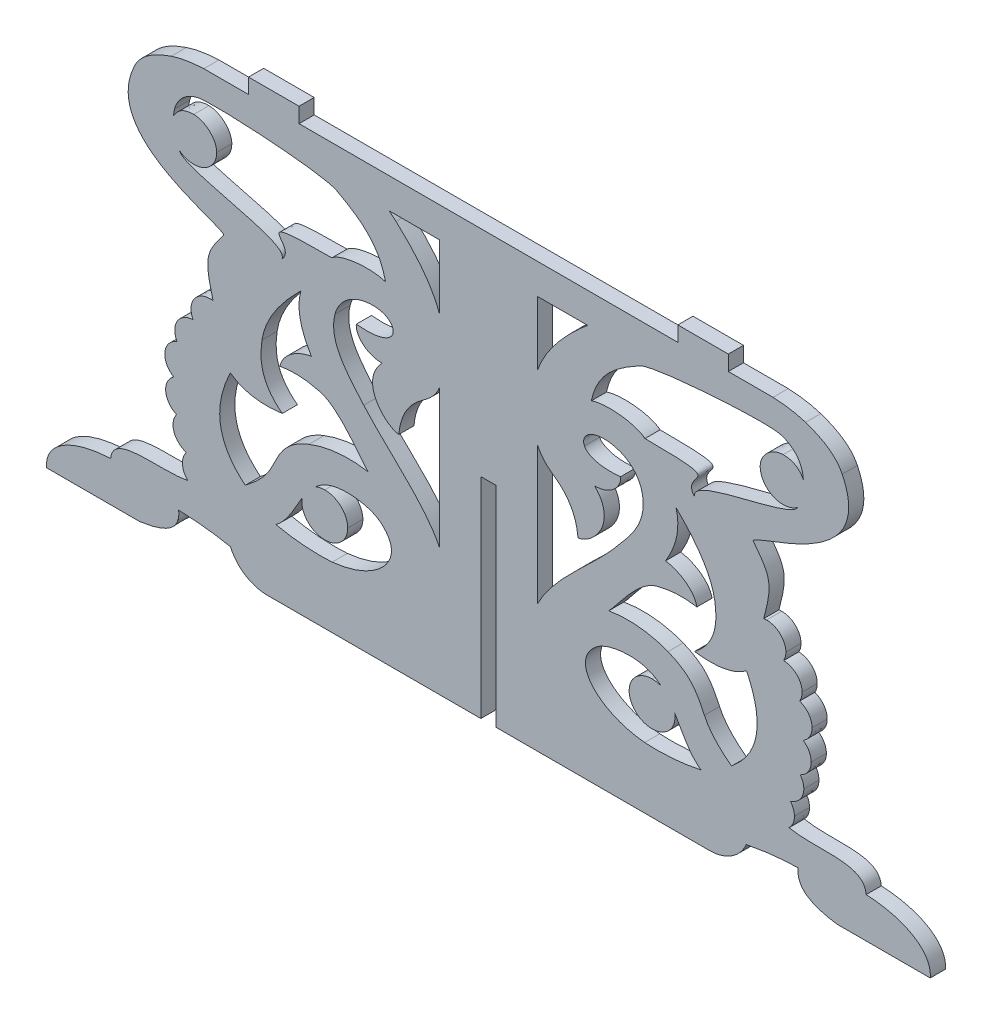
from build123d import *

# Parameters (mm, degrees)
RESSALTO_EXTRUS_O1_DEPTH = 2


with BuildPart() as part:
    # Model → Ressalto-extrusão1 (new body)
    with BuildSketch(Plane.XY):
        with BuildLine():
            Line((-58.0295, -132.7237), (-45.7155, -132.7237))
            add(Edge.make_bspline(
                [(-45.7155, -132.7237), (-42.3585, -132.2526), (-40.3248, -131.1466), (-40.6026, -128.8422)],
                knots=[0.327868852, 0.327868852, 0.327868852, 0.327868852, 0.344262295, 0.344262295, 0.344262295, 0.344262295], degree=3))
            add(Edge.make_bspline(
                [(-40.6026, -128.8422), (-37.8869, -128.9335), (-35.6926, -129.2179), (-33.7519, -129.6077)],
                knots=[0.344262295, 0.344262295, 0.344262295, 0.344262295, 0.360655738, 0.360655738, 0.360655738, 0.360655738], degree=3))
            add(Edge.make_bspline(
                [(-33.7519, -129.6077), (-32.9718, -131.4296), (-31.0759, -132.7237), (-28.8751, -132.7237)],
                knots=[0.360655738, 0.360655738, 0.360655738, 0.360655738, 0.37704918, 0.37704918, 0.37704918, 0.37704918], degree=3))
            Line((-28.8751, -132.7237), (-0.7099, -132.7237))
            Line((-0.7099, -132.7237), (-0.7099, -105.0626))
            Line((-0.7099, -105.0626), (1.2901, -105.0626))
            Line((1.2901, -105.0626), (1.2901, -132.7237))
            Line((1.2901, -132.7237), (29.4553, -132.7237))
            add(Edge.make_bspline(
                [(29.4553, -132.7237), (31.6561, -132.7237), (33.552, -131.4296), (34.3321, -129.6077)],
                knots=[0.459016393, 0.459016393, 0.459016393, 0.459016393, 0.475409836, 0.475409836, 0.475409836, 0.475409836], degree=3))
            add(Edge.make_bspline(
                [(34.3321, -129.6077), (36.2728, -129.2179), (38.4671, -128.9335), (41.1827, -128.8422)],
                knots=[0.475409836, 0.475409836, 0.475409836, 0.475409836, 0.491803279, 0.491803279, 0.491803279, 0.491803279], degree=3))
            add(Edge.make_bspline(
                [(41.1827, -128.8422), (40.905, -131.1466), (42.9386, -132.2526), (46.2957, -132.7237)],
                knots=[0.491803279, 0.491803279, 0.491803279, 0.491803279, 0.508196721, 0.508196721, 0.508196721, 0.508196721], degree=3))
            Line((46.2957, -132.7237), (58.6097, -132.7237))
            add(Edge.make_bspline(
                [(58.6097, -132.7237), (58.8625, -129.8917), (55.5947, -127.6994), (50.1481, -127.4221)],
                knots=[0.524590164, 0.524590164, 0.524590164, 0.524590164, 0.540983607, 0.540983607, 0.540983607, 0.540983607], degree=3))
            add(Edge.make_bspline(
                [(50.1481, -127.4221), (49.8687, -124.0323), (43.6771, -125.6187), (39.976, -124.8607)],
                knots=[0.540983607, 0.540983607, 0.540983607, 0.540983607, 0.557377049, 0.557377049, 0.557377049, 0.557377049], degree=3))
            add(Edge.make_bspline(
                [(39.976, -124.8607), (40.4117, -124.4297), (40.6794, -123.846), (40.6794, -123.2033)],
                knots=[0.557377049, 0.557377049, 0.557377049, 0.557377049, 0.573770492, 0.573770492, 0.573770492, 0.573770492], degree=3))
            add(Edge.make_bspline(
                [(40.6794, -123.2033), (40.6794, -122.6538), (40.4836, -122.1474), (40.1546, -121.7427)],
                knots=[0.573770492, 0.573770492, 0.573770492, 0.573770492, 0.590163934, 0.590163934, 0.590163934, 0.590163934], degree=3))
            add(Edge.make_bspline(
                [(40.1546, -121.7427), (41.1789, -121.4327), (41.9209, -120.5261), (41.9209, -119.456)],
                knots=[0.590163934, 0.590163934, 0.590163934, 0.590163934, 0.606557377, 0.606557377, 0.606557377, 0.606557377], degree=3))
            add(Edge.make_bspline(
                [(41.9209, -119.456), (41.9209, -118.9396), (41.748, -118.4612), (41.4541, -118.0695)],
                knots=[0.606557377, 0.606557377, 0.606557377, 0.606557377, 0.62295082, 0.62295082, 0.62295082, 0.62295082], degree=3))
            add(Edge.make_bspline(
                [(41.4541, -118.0695), (42.3085, -117.6825), (42.8989, -116.8583), (42.8989, -115.9037)],
                knots=[0.62295082, 0.62295082, 0.62295082, 0.62295082, 0.639344262, 0.639344262, 0.639344262, 0.639344262], degree=3))
            add(Edge.make_bspline(
                [(42.8989, -115.9037), (42.8989, -115.0988), (42.4789, -114.3861), (41.8349, -113.9505)],
                knots=[0.639344262, 0.639344262, 0.639344262, 0.639344262, 0.655737705, 0.655737705, 0.655737705, 0.655737705], degree=3))
            add(Edge.make_bspline(
                [(41.8349, -113.9505), (42.5423, -113.524), (43.0118, -112.7766), (43.0118, -111.9255)],
                knots=[0.655737705, 0.655737705, 0.655737705, 0.655737705, 0.672131148, 0.672131148, 0.672131148, 0.672131148], degree=3))
            add(Edge.make_bspline(
                [(43.0118, -111.9255), (43.0118, -110.9011), (42.3319, -110.0264), (41.3753, -109.6816)],
                knots=[0.672131148, 0.672131148, 0.672131148, 0.672131148, 0.68852459, 0.68852459, 0.68852459, 0.68852459], degree=3))
            add(Edge.make_bspline(
                [(41.3753, -109.6816), (41.5791, -109.3362), (41.6954, -108.9387), (41.6954, -108.5154)],
                knots=[0.68852459, 0.68852459, 0.68852459, 0.68852459, 0.704918033, 0.704918033, 0.704918033, 0.704918033], degree=3))
            add(Edge.make_bspline(
                [(41.6954, -108.5154), (41.6954, -107.2239), (40.6149, -106.1704), (39.2612, -106.1166)],
                knots=[0.704918033, 0.704918033, 0.704918033, 0.704918033, 0.721311475, 0.721311475, 0.721311475, 0.721311475], degree=3))
            add(Edge.make_bspline(
                [(39.2612, -106.1166), (39.447, -105.7832), (39.5524, -105.4037), (39.5524, -105.0007)],
                knots=[0.721311475, 0.721311475, 0.721311475, 0.721311475, 0.737704918, 0.737704918, 0.737704918, 0.737704918], degree=3))
            add(Edge.make_bspline(
                [(39.5524, -105.0007), (39.5524, -103.6749), (38.4138, -102.5997), (37.0097, -102.5997)],
                knots=[0.737704918, 0.737704918, 0.737704918, 0.737704918, 0.754098361, 0.754098361, 0.754098361, 0.754098361], degree=3))
            add(Edge.make_bspline(
                [(37.0097, -102.5997), (36.8829, -102.5997), (36.7582, -102.6086), (36.6363, -102.6256)],
                knots=[0.754098361, 0.754098361, 0.754098361, 0.754098361, 0.770491803, 0.770491803, 0.770491803, 0.770491803], degree=3))
            add(Edge.make_bspline(
                [(36.6363, -102.6256), (37.8897, -97.9852), (37.477, -97.3792), (35.2126, -94.4061)],
                knots=[0.770491803, 0.770491803, 0.770491803, 0.770491803, 0.786885246, 0.786885246, 0.786885246, 0.786885246], degree=3))
            add(Edge.make_bspline(
                [(35.2126, -94.4061), (36.2749, -93.1676), (51.5777, -90.379), (46.9881, -80.9351)],
                knots=[0.786885246, 0.786885246, 0.786885246, 0.786885246, 0.803278689, 0.803278689, 0.803278689, 0.803278689], degree=3))
            add(Edge.make_bspline(
                [(46.9881, -80.9351), (46.322, -79.5645), (44.8758, -78.3435), (42.1528, -77.4345)],
                knots=[0.803278689, 0.803278689, 0.803278689, 0.803278689, 0.819672131, 0.819672131, 0.819672131, 0.819672131], degree=3))
            add(Edge.make_bspline(
                [(42.1528, -77.4345), (40.9147, -77.0212), (39.4354, -76.7842), (37.859, -76.7198)],
                knots=[0.819672131, 0.819672131, 0.819672131, 0.819672131, 0.836065574, 0.836065574, 0.836065574, 0.836065574], degree=3))
            Line((37.859, -76.7198), (31.9567, -76.7198))
            Line((31.9567, -76.7198), (31.9567, -74.7247))
            Line((31.9567, -74.7247), (25.2901, -74.7247))
            Line((25.2901, -74.7247), (25.2901, -76.7198))
            add(Edge.make_bspline(
                [(25.2901, -76.7198), (-24.0393, -76.7198), (24.6194, -76.7198), (-24.7099, -76.7198)],
                knots=[0.901639344, 0.901639344, 0.901639344, 0.901639344, 0.918032787, 0.918032787, 0.918032787, 0.918032787], degree=3))
            Line((-24.7099, -76.7198), (-24.7099, -74.7247))
            Line((-24.7099, -74.7247), (-31.3766, -74.7247))
            Line((-31.3766, -74.7247), (-31.3766, -76.7198))
            Line((-31.3766, -76.7198), (-37.2789, -76.7198))
            add(Edge.make_bspline(
                [(-37.2789, -76.7198), (-38.8553, -76.7842), (-40.3345, -77.0212), (-41.5726, -77.4345)],
                knots=[0, 0, 0, 0, 0.016393443, 0.016393443, 0.016393443, 0.016393443], degree=3))
            add(Edge.make_bspline(
                [(-41.5726, -77.4345), (-44.2957, -78.3435), (-45.7419, -79.5645), (-46.408, -80.9351)],
                knots=[0.016393443, 0.016393443, 0.016393443, 0.016393443, 0.032786885, 0.032786885, 0.032786885, 0.032786885], degree=3))
            add(Edge.make_bspline(
                [(-46.408, -80.9351), (-50.9976, -90.379), (-35.6947, -93.1676), (-34.6325, -94.4061)],
                knots=[0.032786885, 0.032786885, 0.032786885, 0.032786885, 0.049180328, 0.049180328, 0.049180328, 0.049180328], degree=3))
            add(Edge.make_bspline(
                [(-34.6325, -94.4061), (-36.8968, -97.3792), (-37.3095, -97.9852), (-36.0561, -102.6256)],
                knots=[0.049180328, 0.049180328, 0.049180328, 0.049180328, 0.06557377, 0.06557377, 0.06557377, 0.06557377], degree=3))
            add(Edge.make_bspline(
                [(-36.0561, -102.6256), (-36.178, -102.6086), (-36.3027, -102.5997), (-36.4296, -102.5997)],
                knots=[0.06557377, 0.06557377, 0.06557377, 0.06557377, 0.081967213, 0.081967213, 0.081967213, 0.081967213], degree=3))
            add(Edge.make_bspline(
                [(-36.4296, -102.5997), (-37.8337, -102.5997), (-38.9723, -103.6749), (-38.9723, -105.0007)],
                knots=[0.081967213, 0.081967213, 0.081967213, 0.081967213, 0.098360656, 0.098360656, 0.098360656, 0.098360656], degree=3))
            add(Edge.make_bspline(
                [(-38.9723, -105.0007), (-38.9723, -105.4037), (-38.8669, -105.7832), (-38.681, -106.1166)],
                knots=[0.098360656, 0.098360656, 0.098360656, 0.098360656, 0.114754098, 0.114754098, 0.114754098, 0.114754098], degree=3))
            add(Edge.make_bspline(
                [(-38.681, -106.1166), (-40.0347, -106.1704), (-41.1152, -107.2239), (-41.1152, -108.5154)],
                knots=[0.114754098, 0.114754098, 0.114754098, 0.114754098, 0.131147541, 0.131147541, 0.131147541, 0.131147541], degree=3))
            add(Edge.make_bspline(
                [(-41.1152, -108.5154), (-41.1152, -108.9387), (-40.9989, -109.3362), (-40.7951, -109.6816)],
                knots=[0.131147541, 0.131147541, 0.131147541, 0.131147541, 0.147540984, 0.147540984, 0.147540984, 0.147540984], degree=3))
            add(Edge.make_bspline(
                [(-40.7951, -109.6816), (-41.7518, -110.0264), (-42.4316, -110.9011), (-42.4316, -111.9255)],
                knots=[0.147540984, 0.147540984, 0.147540984, 0.147540984, 0.163934426, 0.163934426, 0.163934426, 0.163934426], degree=3))
            add(Edge.make_bspline(
                [(-42.4316, -111.9255), (-42.4316, -112.7766), (-41.9621, -113.524), (-41.2547, -113.9505)],
                knots=[0.163934426, 0.163934426, 0.163934426, 0.163934426, 0.180327869, 0.180327869, 0.180327869, 0.180327869], degree=3))
            add(Edge.make_bspline(
                [(-41.2547, -113.9505), (-41.8988, -114.3861), (-42.3188, -115.0988), (-42.3188, -115.9037)],
                knots=[0.180327869, 0.180327869, 0.180327869, 0.180327869, 0.196721311, 0.196721311, 0.196721311, 0.196721311], degree=3))
            add(Edge.make_bspline(
                [(-42.3188, -115.9037), (-42.3188, -116.8583), (-41.7284, -117.6825), (-40.874, -118.0695)],
                knots=[0.196721311, 0.196721311, 0.196721311, 0.196721311, 0.213114754, 0.213114754, 0.213114754, 0.213114754], degree=3))
            add(Edge.make_bspline(
                [(-40.874, -118.0695), (-41.1678, -118.4612), (-41.3407, -118.9396), (-41.3407, -119.456)],
                knots=[0.213114754, 0.213114754, 0.213114754, 0.213114754, 0.229508197, 0.229508197, 0.229508197, 0.229508197], degree=3))
            add(Edge.make_bspline(
                [(-41.3407, -119.456), (-41.3407, -120.5261), (-40.5988, -121.4327), (-39.5745, -121.7427)],
                knots=[0.229508197, 0.229508197, 0.229508197, 0.229508197, 0.245901639, 0.245901639, 0.245901639, 0.245901639], degree=3))
            add(Edge.make_bspline(
                [(-39.5745, -121.7427), (-39.9035, -122.1474), (-40.0993, -122.6538), (-40.0993, -123.2033)],
                knots=[0.245901639, 0.245901639, 0.245901639, 0.245901639, 0.262295082, 0.262295082, 0.262295082, 0.262295082], degree=3))
            add(Edge.make_bspline(
                [(-40.0993, -123.2033), (-40.0993, -123.846), (-39.8315, -124.4297), (-39.3959, -124.8607)],
                knots=[0.262295082, 0.262295082, 0.262295082, 0.262295082, 0.278688525, 0.278688525, 0.278688525, 0.278688525], degree=3))
            add(Edge.make_bspline(
                [(-39.3959, -124.8607), (-43.0969, -125.6187), (-49.2885, -124.0323), (-49.5679, -127.4221)],
                knots=[0.278688525, 0.278688525, 0.278688525, 0.278688525, 0.295081967, 0.295081967, 0.295081967, 0.295081967], degree=3))
            add(Edge.make_bspline(
                [(-49.5679, -127.4221), (-55.0145, -127.6994), (-58.2823, -129.8917), (-58.0295, -132.7237)],
                knots=[0.295081967, 0.295081967, 0.295081967, 0.295081967, 0.31147541, 0.31147541, 0.31147541, 0.31147541], degree=3))
        make_face()
        with BuildLine():
            Line((41.8464, -84.1013), (41.8509, -84.0772))
            add(Edge.make_bspline(
                [(41.8509, -84.0772), (41.8313, -83.7922), (41.7887, -83.5147), (41.7202, -83.2484)],
                knots=[0.357142857, 0.357142857, 0.357142857, 0.357142857, 0.428571429, 0.428571429, 0.428571429, 0.428571429], degree=3))
            add(Edge.make_bspline(
                [(41.7202, -83.2484), (41.4272, -82.1106), (40.448, -80.7996), (38.5962, -80.4169)],
                knots=[0.428571429, 0.428571429, 0.428571429, 0.428571429, 0.5, 0.5, 0.5, 0.5], degree=3))
            add(Edge.make_bspline(
                [(38.5962, -80.4169), (36.406, -79.964), (22.1887, -80.8345), (20.2699, -81.9129)],
                knots=[0.5, 0.5, 0.5, 0.5, 0.571428571, 0.571428571, 0.571428571, 0.571428571], degree=3))
            add(Edge.make_bspline(
                [(20.2699, -81.9129), (17.8156, -83.2923), (14.7391, -84.986), (13.8733, -89.1082)],
                knots=[0.571428571, 0.571428571, 0.571428571, 0.571428571, 0.642857143, 0.642857143, 0.642857143, 0.642857143], degree=3))
            add(Edge.make_bspline(
                [(13.8733, -89.1082), (15.6554, -88.4485), (19.6405, -88.7534), (20.951, -89.8868)],
                knots=[0.642857143, 0.642857143, 0.642857143, 0.642857143, 0.714285714, 0.714285714, 0.714285714, 0.714285714], degree=3))
            add(Edge.make_bspline(
                [(20.951, -89.8868), (32.8615, -89.8868), (25.4889, -90.8661), (27.4601, -93.2254)],
                knots=[0.714285714, 0.714285714, 0.714285714, 0.714285714, 0.785714286, 0.785714286, 0.785714286, 0.785714286], degree=3))
            Line((27.4601, -93.2254), (27.5114, -93.2255))
            add(Edge.make_bspline(
                [(27.5114, -93.2255), (26.8882, -90.9726), (40.2299, -89.6032), (41.0991, -87.676)],
                knots=[0.857142857, 0.857142857, 0.857142857, 0.857142857, 1, 1, 1, 1], degree=3))
            add(Edge.make_bspline(
                [(41.0991, -87.676), (40.5779, -88.0781), (39.9123, -88.3192), (39.1869, -88.3193)],
                knots=[0, 0, 0, 0, 0.071428571, 0.071428571, 0.071428571, 0.071428571], degree=3))
            add(Edge.make_bspline(
                [(39.1869, -88.3193), (37.5166, -88.3192), (36.162, -87.0406), (36.162, -85.4632)],
                knots=[0.071428571, 0.071428571, 0.071428571, 0.071428571, 0.142857143, 0.142857143, 0.142857143, 0.142857143], degree=3))
            add(Edge.make_bspline(
                [(36.162, -85.4632), (36.162, -83.8859), (37.7777, -82.6064), (39.1869, -82.6064)],
                knots=[0.142857143, 0.142857143, 0.142857143, 0.142857143, 0.214285714, 0.214285714, 0.214285714, 0.214285714], degree=3))
            add(Edge.make_bspline(
                [(39.1869, -82.6064), (40.5962, -82.6063), (41.3341, -83.211), (41.8464, -84.1013)],
                knots=[0.214285714, 0.214285714, 0.214285714, 0.214285714, 0.285714286, 0.285714286, 0.285714286, 0.285714286], degree=3))
        make_face(mode=Mode.SUBTRACT)
        with BuildLine():
            Line((6.7678, -115.8622), (6.7678, -97.6611))
            add(Edge.make_bspline(
                [(6.7678, -97.6611), (7.1177, -98.522), (7.7821, -99.3416), (8.8217, -100.0587)],
                knots=[0.083333333, 0.083333333, 0.083333333, 0.083333333, 0.166666667, 0.166666667, 0.166666667, 0.166666667], degree=3))
            add(Edge.make_bspline(
                [(8.8217, -100.0587), (10.4062, -101.1516), (11.8709, -102.7858), (12.1135, -105.6647)],
                knots=[0.166666667, 0.166666667, 0.166666667, 0.166666667, 0.25, 0.25, 0.25, 0.25], degree=3))
            add(Edge.make_bspline(
                [(12.1135, -105.6647), (14.0789, -105.4211), (17.4305, -101.7668), (14.3074, -98.6123)],
                knots=[0.25, 0.25, 0.25, 0.25, 0.333333333, 0.333333333, 0.333333333, 0.333333333], degree=3))
            add(Edge.make_bspline(
                [(14.3074, -98.6123), (16.2667, -98.6614), (17.8601, -97.2088), (17.7312, -95.86)],
                knots=[0.333333333, 0.333333333, 0.333333333, 0.333333333, 0.416666667, 0.416666667, 0.416666667, 0.416666667], degree=3))
            add(Edge.make_bspline(
                [(17.7312, -95.86), (14.9058, -96.1563), (13.3648, -95.515), (12.9675, -94.7212)],
                knots=[0.416666667, 0.416666667, 0.416666667, 0.416666667, 0.5, 0.5, 0.5, 0.5], degree=3))
            add(Edge.make_bspline(
                [(12.9675, -94.7212), (12.7751, -94.3367), (12.8359, -93.9163), (13.1165, -93.5418)],
                knots=[0.5, 0.5, 0.5, 0.5, 0.583333333, 0.583333333, 0.583333333, 0.583333333], degree=3))
            add(Edge.make_bspline(
                [(13.1165, -93.5418), (13.9625, -92.4129), (16.199, -92.4035), (17.7583, -93.0431)],
                knots=[0.583333333, 0.583333333, 0.583333333, 0.583333333, 0.666666667, 0.666666667, 0.666666667, 0.666666667], degree=3))
            add(Edge.make_bspline(
                [(17.7583, -93.0431), (19.301, -93.6758), (20.2207, -94.8543), (20.5427, -96.1188)],
                knots=[0.666666667, 0.666666667, 0.666666667, 0.666666667, 0.75, 0.75, 0.75, 0.75], degree=3))
            add(Edge.make_bspline(
                [(20.5427, -96.1188), (21.4025, -99.4953), (19.0104, -102.0369), (16.7475, -104.6339)],
                knots=[0.75, 0.75, 0.75, 0.75, 0.833333333, 0.833333333, 0.833333333, 0.833333333], degree=3))
            add(Edge.make_bspline(
                [(16.7475, -104.6339), (13.6063, -108.239), (8.8067, -111.7552), (6.7678, -115.8622)],
                knots=[0.833333333, 0.833333333, 0.833333333, 0.833333333, 1, 1, 1, 1], degree=3))
        make_face(mode=Mode.SUBTRACT)
        with BuildLine():
            Line((25.2636, -95.9326), (25.2605, -95.9344))
            Line((25.2605, -95.9344), (25.2233, -95.8931))
            add(Edge.make_bspline(
                [(25.2233, -95.8931), (25.1662, -95.8373), (25.1087, -95.7815), (25.0509, -95.7255)],
                knots=[0.133333333, 0.133333333, 0.133333333, 0.133333333, 0.2, 0.2, 0.2, 0.2], degree=3))
            add(Edge.make_bspline(
                [(25.0509, -95.7255), (25.6852, -98.0721), (25.0055, -100.2976), (23.6733, -102.5024)],
                knots=[0.2, 0.2, 0.2, 0.2, 0.266666667, 0.266666667, 0.266666667, 0.266666667], degree=3))
            add(Edge.make_bspline(
                [(23.6733, -102.5024), (25.5011, -102.8033), (27.4577, -104.0051), (27.8065, -105.7119)],
                knots=[0.266666667, 0.266666667, 0.266666667, 0.266666667, 0.333333333, 0.333333333, 0.333333333, 0.333333333], degree=3))
            add(Edge.make_bspline(
                [(27.8065, -105.7119), (26.0758, -105.4045), (24.4417, -105.4953), (22.61, -105.9561)],
                knots=[0.333333333, 0.333333333, 0.333333333, 0.333333333, 0.4, 0.4, 0.4, 0.4], degree=3))
            add(Edge.make_bspline(
                [(22.61, -105.9561), (19.945, -106.6266), (17.4208, -110.716), (16.1735, -111.9637)],
                knots=[0.4, 0.4, 0.4, 0.4, 0.466666667, 0.466666667, 0.466666667, 0.466666667], degree=3))
            add(Edge.make_bspline(
                [(16.1735, -111.9637), (19.0564, -111.4458), (21.8473, -111.8747), (23.993, -112.7238)],
                knots=[0.466666667, 0.466666667, 0.466666667, 0.466666667, 0.533333333, 0.533333333, 0.533333333, 0.533333333], degree=3))
            add(Edge.make_bspline(
                [(23.993, -112.7238), (27.0207, -113.9218), (27.8131, -115.5233), (28.7997, -117.5912)],
                knots=[0.533333333, 0.533333333, 0.533333333, 0.533333333, 0.6, 0.6, 0.6, 0.6], degree=3))
            add(Edge.make_bspline(
                [(28.7997, -117.5912), (29.3141, -118.6694), (30.133, -119.916), (32.3886, -121.6047)],
                knots=[0.6, 0.6, 0.6, 0.6, 0.666666667, 0.666666667, 0.666666667, 0.666666667], degree=3))
            add(Edge.make_bspline(
                [(32.3886, -121.6047), (35.742, -118.8327), (36.9574, -115.1182), (34.3619, -109.7241)],
                knots=[0.666666667, 0.666666667, 0.666666667, 0.666666667, 0.733333333, 0.733333333, 0.733333333, 0.733333333], degree=3))
            add(Edge.make_bspline(
                [(34.3619, -109.7241), (32.6868, -111.0084), (30.2026, -111.343), (27.4986, -110.9533)],
                knots=[0.733333333, 0.733333333, 0.733333333, 0.733333333, 0.8, 0.8, 0.8, 0.8], degree=3))
            add(Edge.make_bspline(
                [(27.4986, -110.9533), (30.2732, -108.8598), (30.5616, -106.3477), (30.1795, -103.8887)],
                knots=[0.8, 0.8, 0.8, 0.8, 0.866666667, 0.866666667, 0.866666667, 0.866666667], degree=3))
            add(Edge.make_bspline(
                [(30.1795, -103.8887), (29.7867, -101.3608), (28.096, -98.7158), (25.2636, -95.9326)],
                knots=[0.866666667, 0.866666667, 0.866666667, 0.866666667, 1, 1, 1, 1], degree=3))
        make_face(mode=Mode.SUBTRACT)
        with BuildLine():
            Line((6.7678, -89.1619), (6.7678, -80.731))
            Line((6.7678, -80.731), (13.3925, -80.731))
            add(Edge.make_bspline(
                [(13.3925, -80.731), (13.0822, -80.9769), (12.7813, -81.2312), (12.4899, -81.4933)],
                knots=[0.4, 0.4, 0.4, 0.4, 0.6, 0.6, 0.6, 0.6], degree=3))
            add(Edge.make_bspline(
                [(12.4899, -81.4933), (9.9255, -83.8), (7.6953, -86.4622), (6.7678, -89.1619)],
                knots=[0.6, 0.6, 0.6, 0.6, 1, 1, 1, 1], degree=3))
        make_face(mode=Mode.SUBTRACT)
        with BuildLine():
            Line((-41.2663, -84.1013), (-41.2707, -84.0772))
            add(Edge.make_bspline(
                [(-41.2707, -84.0772), (-41.2511, -83.7922), (-41.2086, -83.5147), (-41.14, -83.2484)],
                knots=[0.357142857, 0.357142857, 0.357142857, 0.357142857, 0.428571429, 0.428571429, 0.428571429, 0.428571429], degree=3))
            add(Edge.make_bspline(
                [(-41.14, -83.2484), (-40.847, -82.1106), (-39.8679, -80.7996), (-38.0161, -80.4169)],
                knots=[0.428571429, 0.428571429, 0.428571429, 0.428571429, 0.5, 0.5, 0.5, 0.5], degree=3))
            add(Edge.make_bspline(
                [(-38.0161, -80.4169), (-35.8259, -79.964), (-21.6086, -80.8345), (-19.6898, -81.9129)],
                knots=[0.5, 0.5, 0.5, 0.5, 0.571428571, 0.571428571, 0.571428571, 0.571428571], degree=3))
            add(Edge.make_bspline(
                [(-19.6898, -81.9129), (-17.2355, -83.2923), (-14.1589, -84.986), (-13.2931, -89.1082)],
                knots=[0.571428571, 0.571428571, 0.571428571, 0.571428571, 0.642857143, 0.642857143, 0.642857143, 0.642857143], degree=3))
            add(Edge.make_bspline(
                [(-13.2931, -89.1082), (-15.0753, -88.4485), (-19.0603, -88.7534), (-20.3708, -89.8868)],
                knots=[0.642857143, 0.642857143, 0.642857143, 0.642857143, 0.714285714, 0.714285714, 0.714285714, 0.714285714], degree=3))
            add(Edge.make_bspline(
                [(-20.3708, -89.8868), (-32.2813, -89.8868), (-24.9088, -90.8661), (-26.8799, -93.2254)],
                knots=[0.714285714, 0.714285714, 0.714285714, 0.714285714, 0.785714286, 0.785714286, 0.785714286, 0.785714286], degree=3))
            Line((-26.8799, -93.2254), (-26.9313, -93.2255))
            add(Edge.make_bspline(
                [(-26.9313, -93.2255), (-26.308, -90.9726), (-39.6497, -89.6032), (-40.5189, -87.676)],
                knots=[0.857142857, 0.857142857, 0.857142857, 0.857142857, 1, 1, 1, 1], degree=3))
            add(Edge.make_bspline(
                [(-40.5189, -87.676), (-39.9977, -88.0781), (-39.3321, -88.3192), (-38.6068, -88.3193)],
                knots=[0, 0, 0, 0, 0.071428571, 0.071428571, 0.071428571, 0.071428571], degree=3))
            add(Edge.make_bspline(
                [(-38.6068, -88.3193), (-36.9365, -88.3192), (-35.5819, -87.0406), (-35.5819, -85.4632)],
                knots=[0.071428571, 0.071428571, 0.071428571, 0.071428571, 0.142857143, 0.142857143, 0.142857143, 0.142857143], degree=3))
            add(Edge.make_bspline(
                [(-35.5819, -85.4632), (-35.5819, -83.8859), (-37.1975, -82.6064), (-38.6068, -82.6064)],
                knots=[0.142857143, 0.142857143, 0.142857143, 0.142857143, 0.214285714, 0.214285714, 0.214285714, 0.214285714], degree=3))
            add(Edge.make_bspline(
                [(-38.6068, -82.6064), (-40.016, -82.6063), (-40.754, -83.211), (-41.2663, -84.1013)],
                knots=[0.214285714, 0.214285714, 0.214285714, 0.214285714, 0.285714286, 0.285714286, 0.285714286, 0.285714286], degree=3))
        make_face(mode=Mode.SUBTRACT)
        with BuildLine():
            Line((-6.1877, -115.8622), (-6.1877, -97.6611))
            add(Edge.make_bspline(
                [(-6.1877, -97.6611), (-6.5375, -98.522), (-7.202, -99.3416), (-8.2415, -100.0587)],
                knots=[0.083333333, 0.083333333, 0.083333333, 0.083333333, 0.166666667, 0.166666667, 0.166666667, 0.166666667], degree=3))
            add(Edge.make_bspline(
                [(-8.2415, -100.0587), (-9.826, -101.1516), (-11.2907, -102.7858), (-11.5334, -105.6647)],
                knots=[0.166666667, 0.166666667, 0.166666667, 0.166666667, 0.25, 0.25, 0.25, 0.25], degree=3))
            add(Edge.make_bspline(
                [(-11.5334, -105.6647), (-13.4988, -105.4211), (-16.8504, -101.7668), (-13.7272, -98.6123)],
                knots=[0.25, 0.25, 0.25, 0.25, 0.333333333, 0.333333333, 0.333333333, 0.333333333], degree=3))
            add(Edge.make_bspline(
                [(-13.7272, -98.6123), (-15.6865, -98.6614), (-17.2799, -97.2088), (-17.151, -95.86)],
                knots=[0.333333333, 0.333333333, 0.333333333, 0.333333333, 0.416666667, 0.416666667, 0.416666667, 0.416666667], degree=3))
            add(Edge.make_bspline(
                [(-17.151, -95.86), (-14.3257, -96.1563), (-12.7846, -95.515), (-12.3874, -94.7212)],
                knots=[0.416666667, 0.416666667, 0.416666667, 0.416666667, 0.5, 0.5, 0.5, 0.5], degree=3))
            add(Edge.make_bspline(
                [(-12.3874, -94.7212), (-12.195, -94.3367), (-12.2557, -93.9163), (-12.5364, -93.5418)],
                knots=[0.5, 0.5, 0.5, 0.5, 0.583333333, 0.583333333, 0.583333333, 0.583333333], degree=3))
            add(Edge.make_bspline(
                [(-12.5364, -93.5418), (-13.3823, -92.4129), (-15.6188, -92.4035), (-17.1782, -93.0431)],
                knots=[0.583333333, 0.583333333, 0.583333333, 0.583333333, 0.666666667, 0.666666667, 0.666666667, 0.666666667], degree=3))
            add(Edge.make_bspline(
                [(-17.1782, -93.0431), (-18.7209, -93.6758), (-19.6406, -94.8543), (-19.9625, -96.1188)],
                knots=[0.666666667, 0.666666667, 0.666666667, 0.666666667, 0.75, 0.75, 0.75, 0.75], degree=3))
            add(Edge.make_bspline(
                [(-19.9625, -96.1188), (-20.8224, -99.4953), (-18.4302, -102.0369), (-16.1674, -104.6339)],
                knots=[0.75, 0.75, 0.75, 0.75, 0.833333333, 0.833333333, 0.833333333, 0.833333333], degree=3))
            add(Edge.make_bspline(
                [(-16.1674, -104.6339), (-13.0261, -108.239), (-8.2265, -111.7552), (-6.1877, -115.8622)],
                knots=[0.833333333, 0.833333333, 0.833333333, 0.833333333, 1, 1, 1, 1], degree=3))
        make_face(mode=Mode.SUBTRACT)
        with BuildLine():
            Line((-24.6834, -95.9326), (-24.6804, -95.9344))
            Line((-24.6804, -95.9344), (-24.6431, -95.8931))
            add(Edge.make_bspline(
                [(-24.6431, -95.8931), (-24.5861, -95.8373), (-24.5286, -95.7815), (-24.4707, -95.7255)],
                knots=[0.133333333, 0.133333333, 0.133333333, 0.133333333, 0.2, 0.2, 0.2, 0.2], degree=3))
            add(Edge.make_bspline(
                [(-24.4707, -95.7255), (-25.105, -98.0721), (-24.4253, -100.2976), (-23.0931, -102.5024)],
                knots=[0.2, 0.2, 0.2, 0.2, 0.266666667, 0.266666667, 0.266666667, 0.266666667], degree=3))
            add(Edge.make_bspline(
                [(-23.0931, -102.5024), (-24.921, -102.8033), (-26.8776, -104.0051), (-27.2264, -105.7119)],
                knots=[0.266666667, 0.266666667, 0.266666667, 0.266666667, 0.333333333, 0.333333333, 0.333333333, 0.333333333], degree=3))
            add(Edge.make_bspline(
                [(-27.2264, -105.7119), (-25.4957, -105.4045), (-23.8615, -105.4953), (-22.0299, -105.9561)],
                knots=[0.333333333, 0.333333333, 0.333333333, 0.333333333, 0.4, 0.4, 0.4, 0.4], degree=3))
            add(Edge.make_bspline(
                [(-22.0299, -105.9561), (-19.3648, -106.6266), (-16.8406, -110.716), (-15.5933, -111.9637)],
                knots=[0.4, 0.4, 0.4, 0.4, 0.466666667, 0.466666667, 0.466666667, 0.466666667], degree=3))
            add(Edge.make_bspline(
                [(-15.5933, -111.9637), (-18.4762, -111.4458), (-21.2671, -111.8747), (-23.4129, -112.7238)],
                knots=[0.466666667, 0.466666667, 0.466666667, 0.466666667, 0.533333333, 0.533333333, 0.533333333, 0.533333333], degree=3))
            add(Edge.make_bspline(
                [(-23.4129, -112.7238), (-26.4406, -113.9218), (-27.233, -115.5233), (-28.2196, -117.5912)],
                knots=[0.533333333, 0.533333333, 0.533333333, 0.533333333, 0.6, 0.6, 0.6, 0.6], degree=3))
            add(Edge.make_bspline(
                [(-28.2196, -117.5912), (-28.734, -118.6694), (-29.5528, -119.916), (-31.8084, -121.6047)],
                knots=[0.6, 0.6, 0.6, 0.6, 0.666666667, 0.666666667, 0.666666667, 0.666666667], degree=3))
            add(Edge.make_bspline(
                [(-31.8084, -121.6047), (-35.1618, -118.8327), (-36.3773, -115.1182), (-33.7818, -109.7241)],
                knots=[0.666666667, 0.666666667, 0.666666667, 0.666666667, 0.733333333, 0.733333333, 0.733333333, 0.733333333], degree=3))
            add(Edge.make_bspline(
                [(-33.7818, -109.7241), (-32.1066, -111.0084), (-29.6224, -111.343), (-26.9184, -110.9533)],
                knots=[0.733333333, 0.733333333, 0.733333333, 0.733333333, 0.8, 0.8, 0.8, 0.8], degree=3))
            add(Edge.make_bspline(
                [(-26.9184, -110.9533), (-29.693, -108.8598), (-29.9814, -106.3477), (-29.5994, -103.8887)],
                knots=[0.8, 0.8, 0.8, 0.8, 0.866666667, 0.866666667, 0.866666667, 0.866666667], degree=3))
            add(Edge.make_bspline(
                [(-29.5994, -103.8887), (-29.2066, -101.3608), (-27.5159, -98.7158), (-24.6834, -95.9326)],
                knots=[0.866666667, 0.866666667, 0.866666667, 0.866666667, 1, 1, 1, 1], degree=3))
        make_face(mode=Mode.SUBTRACT)
        with BuildLine():
            Line((-6.1877, -89.1619), (-6.1877, -80.731))
            Line((-6.1877, -80.731), (-12.8123, -80.731))
            add(Edge.make_bspline(
                [(-12.8123, -80.731), (-12.5021, -80.9769), (-12.2011, -81.2312), (-11.9097, -81.4933)],
                knots=[0.4, 0.4, 0.4, 0.4, 0.6, 0.6, 0.6, 0.6], degree=3))
            add(Edge.make_bspline(
                [(-11.9097, -81.4933), (-9.3454, -83.8), (-7.1151, -86.4622), (-6.1877, -89.1619)],
                knots=[0.6, 0.6, 0.6, 0.6, 1, 1, 1, 1], degree=3))
        make_face(mode=Mode.SUBTRACT)
        with BuildLine():
            add(Edge.make_bspline(
                [(21.8901, -116.8855), (20.2198, -116.8855), (18.8652, -118.1648), (18.8652, -119.7423)],
                knots=[0, 0, 0, 0, 0.090909091, 0.090909091, 0.090909091, 0.090909091], degree=3))
            add(Edge.make_bspline(
                [(18.8652, -119.7423), (18.8652, -121.3194), (20.2198, -122.5984), (21.8901, -122.5984)],
                knots=[0.090909091, 0.090909091, 0.090909091, 0.090909091, 0.181818182, 0.181818182, 0.181818182, 0.181818182], degree=3))
            add(Edge.make_bspline(
                [(21.8901, -122.5984), (23.5605, -122.5984), (24.915, -121.3194), (24.915, -119.7423)],
                knots=[0.181818182, 0.181818182, 0.181818182, 0.181818182, 0.272727273, 0.272727273, 0.272727273, 0.272727273], degree=3))
            add(Edge.make_bspline(
                [(24.915, -119.7423), (24.915, -119.5879), (24.9018, -119.4365), (24.8768, -119.2889)],
                knots=[0.272727273, 0.272727273, 0.272727273, 0.272727273, 0.363636364, 0.363636364, 0.363636364, 0.363636364], degree=3))
            add(Edge.make_bspline(
                [(24.8768, -119.2889), (25.9318, -120.9903), (26.7068, -122.8792), (28.3424, -124.0683)],
                knots=[0.363636364, 0.363636364, 0.363636364, 0.363636364, 0.454545455, 0.454545455, 0.454545455, 0.454545455], degree=3))
            add(Edge.make_bspline(
                [(28.3424, -124.0683), (25.7833, -124.6749), (22.5117, -124.8008), (20.911, -124.6529)],
                knots=[0.454545455, 0.454545455, 0.454545455, 0.454545455, 0.545454545, 0.545454545, 0.545454545, 0.545454545], degree=3))
            add(Edge.make_bspline(
                [(20.911, -124.6529), (15.1322, -124.1188), (10.6438, -119.9918), (14.5848, -116.8748)],
                knots=[0.545454545, 0.545454545, 0.545454545, 0.545454545, 0.636363636, 0.636363636, 0.636363636, 0.636363636], degree=3))
            add(Edge.make_bspline(
                [(14.5848, -116.8748), (16.0936, -115.6814), (19.8733, -115.2077), (22.0533, -116.3974)],
                knots=[0.636363636, 0.636363636, 0.636363636, 0.636363636, 0.727272727, 0.727272727, 0.727272727, 0.727272727], degree=3))
            add(Edge.make_bspline(
                [(22.0533, -116.3974), (22.4453, -116.6113), (22.7943, -116.8573), (23.1104, -117.1278)],
                knots=[0.727272727, 0.727272727, 0.727272727, 0.727272727, 0.818181818, 0.818181818, 0.818181818, 0.818181818], degree=3))
            add(Edge.make_bspline(
                [(23.1104, -117.1278), (22.7371, -116.972), (22.3244, -116.8855), (21.8901, -116.8855)],
                knots=[0.818181818, 0.818181818, 0.818181818, 0.818181818, 1, 1, 1, 1], degree=3))
        make_face(mode=Mode.SUBTRACT)
        with BuildLine():
            add(Edge.make_bspline(
                [(-21.3099, -116.8855), (-19.6397, -116.8855), (-18.2851, -118.1648), (-18.2851, -119.7423)],
                knots=[0, 0, 0, 0, 0.090909091, 0.090909091, 0.090909091, 0.090909091], degree=3))
            add(Edge.make_bspline(
                [(-18.2851, -119.7423), (-18.2851, -121.3194), (-19.6397, -122.5984), (-21.3099, -122.5984)],
                knots=[0.090909091, 0.090909091, 0.090909091, 0.090909091, 0.181818182, 0.181818182, 0.181818182, 0.181818182], degree=3))
            add(Edge.make_bspline(
                [(-21.3099, -122.5984), (-22.9803, -122.5984), (-24.3349, -121.3194), (-24.3349, -119.7423)],
                knots=[0.181818182, 0.181818182, 0.181818182, 0.181818182, 0.272727273, 0.272727273, 0.272727273, 0.272727273], degree=3))
            add(Edge.make_bspline(
                [(-24.3349, -119.7423), (-24.3349, -119.5879), (-24.3216, -119.4365), (-24.2967, -119.2889)],
                knots=[0.272727273, 0.272727273, 0.272727273, 0.272727273, 0.363636364, 0.363636364, 0.363636364, 0.363636364], degree=3))
            add(Edge.make_bspline(
                [(-24.2967, -119.2889), (-25.3516, -120.9903), (-26.1266, -122.8792), (-27.7623, -124.0683)],
                knots=[0.363636364, 0.363636364, 0.363636364, 0.363636364, 0.454545455, 0.454545455, 0.454545455, 0.454545455], degree=3))
            add(Edge.make_bspline(
                [(-27.7623, -124.0683), (-25.2031, -124.6749), (-21.9316, -124.8008), (-20.3309, -124.6529)],
                knots=[0.454545455, 0.454545455, 0.454545455, 0.454545455, 0.545454545, 0.545454545, 0.545454545, 0.545454545], degree=3))
            add(Edge.make_bspline(
                [(-20.3309, -124.6529), (-14.552, -124.1188), (-10.0636, -119.9918), (-14.0046, -116.8748)],
                knots=[0.545454545, 0.545454545, 0.545454545, 0.545454545, 0.636363636, 0.636363636, 0.636363636, 0.636363636], degree=3))
            add(Edge.make_bspline(
                [(-14.0046, -116.8748), (-15.5134, -115.6814), (-19.2931, -115.2077), (-21.4731, -116.3974)],
                knots=[0.636363636, 0.636363636, 0.636363636, 0.636363636, 0.727272727, 0.727272727, 0.727272727, 0.727272727], degree=3))
            add(Edge.make_bspline(
                [(-21.4731, -116.3974), (-21.8651, -116.6113), (-22.2141, -116.8573), (-22.5303, -117.1278)],
                knots=[0.727272727, 0.727272727, 0.727272727, 0.727272727, 0.818181818, 0.818181818, 0.818181818, 0.818181818], degree=3))
            add(Edge.make_bspline(
                [(-22.5303, -117.1278), (-22.157, -116.972), (-21.7442, -116.8855), (-21.3099, -116.8855)],
                knots=[0.818181818, 0.818181818, 0.818181818, 0.818181818, 1, 1, 1, 1], degree=3))
        make_face(mode=Mode.SUBTRACT)
    extrude(amount=RESSALTO_EXTRUS_O1_DEPTH)


solid = part.part
